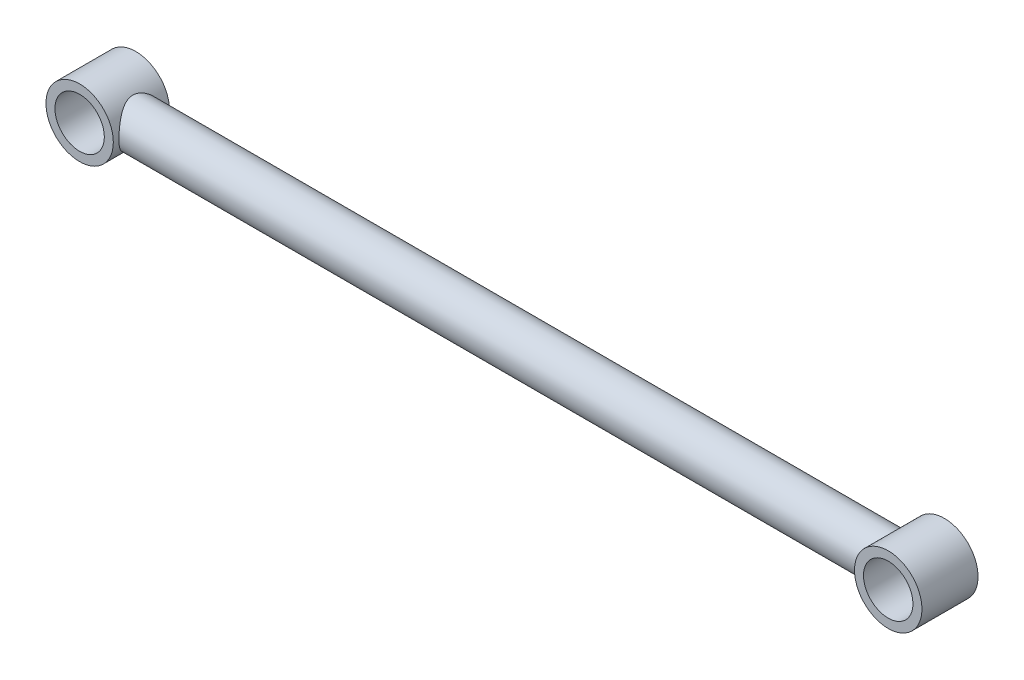
from build123d import *

# Parameters (mm, degrees)
SKETCH3_R                            = 9.525
SKETCH3_R_2                          = 6.985
BOSS_EXTRUDE1_DEPTH                  = 7.9375
BOSS_EXTRUDE1_2_DEPTH                = 7.9375
BOSS_EXTRUDE2_REACH                  = 126.444
BOSS_EXTRUDE2_END_RADIUS             = 9.525
SKETCH4_R                            = 6.35
BOSS_EXTRUDE2_DIRECTION_2_REACH      = 126.444
BOSS_EXTRUDE2_DIRECTION_2_END_RADIUS = 9.525


with BuildPart() as part:
    # Sketch3 → Boss-Extrude1 (new, symmetric)
    with BuildSketch(Plane.XY):
        with Locations((-114.3, 0)):
            Circle(SKETCH3_R)
        with Locations((-114.3, 0)):
            Circle(SKETCH3_R_2, mode=Mode.SUBTRACT)
    extrude(amount=BOSS_EXTRUDE1_DEPTH, both=True)



with BuildPart() as body_2:
    # Sketch3 → Boss-Extrude1 2 (new, symmetric)
    with BuildSketch(Plane.XY):
        with Locations(Location((114.3, 0, 0), (0, 0, 180))):
            Circle(SKETCH3_R)
        with Locations(Location((114.3, 0, 0), (0, 0, 180))):
            Circle(SKETCH3_R_2, mode=Mode.SUBTRACT)
    extrude(amount=BOSS_EXTRUDE1_2_DEPTH, both=True)


with BuildPart() as part_1:
    add(part.part)

    add(body_2.part)  # Boss-Extrude2 merges body 2
    # Boss-Extrude2: up to this cylinder (the profile starts outside it)
    boss_extrude2_end = Plane(origin=(-114.3, 0, 0), z_dir=(0, 0, -1)) * Cylinder(BOSS_EXTRUDE2_END_RADIUS, 272.938, mode=Mode.PRIVATE)
    # Sketch4 → Boss-Extrude2 (add, up to the surface)
    with BuildSketch(Plane(origin=(0, 0, 0), x_dir=(0, 0, -1), z_dir=(1, 0, 0)), mode=Mode.PRIVATE) as boss_extrude2_sk1:
        with Locations(Location((0, 0, 0), (0, 0, 179.999999999))):
            Circle(SKETCH4_R)
    boss_extrude2_tool1 = extrude(boss_extrude2_sk1.sketch, amount=-BOSS_EXTRUDE2_REACH, mode=Mode.PRIVATE) - boss_extrude2_end
    add(boss_extrude2_tool1.solids().sort_by_distance((0, 0, 0))[0])

    # Boss-Extrude2 direction 2: up to this cylinder (the profile starts outside it)
    boss_extrude2_direction_2_end = Plane(origin=(114.3, 0, 0), z_dir=(0, 0, -1)) * Cylinder(BOSS_EXTRUDE2_DIRECTION_2_END_RADIUS, 272.938, mode=Mode.PRIVATE)
    # Sketch4 → Boss-Extrude2 direction 2 (add, up to the surface)
    with BuildSketch(Plane(origin=(0, 0, 0), x_dir=(0, 0, -1), z_dir=(1, 0, 0)), mode=Mode.PRIVATE) as boss_extrude2_direction_2_sk1:
        with Locations(Location((0, 0, 0), (0, 0, 179.999999999))):
            Circle(SKETCH4_R)
    boss_extrude2_direction_2_tool1 = extrude(boss_extrude2_direction_2_sk1.sketch, amount=BOSS_EXTRUDE2_DIRECTION_2_REACH, mode=Mode.PRIVATE) - boss_extrude2_direction_2_end
    add(boss_extrude2_direction_2_tool1.solids().sort_by_distance((0, 0, 0))[0])


solid = part_1.part
